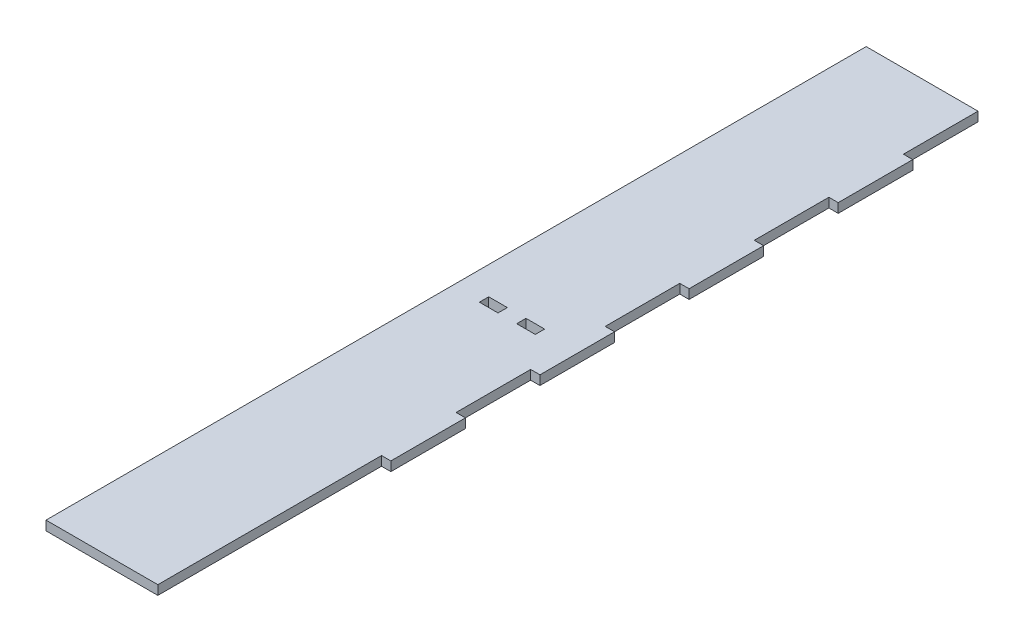
from build123d import *

# Parameters (mm, degrees)
SKETCH1_W           = 76.2
SKETCH1_H           = 6.35
BOSS_EXTRUDE1_DEPTH = 558.8
SKETCH2_W           = 12.7
SKETCH2_H           = 6.35
CUT_EXTRUDE1_DEPTH  = 561.133352426
SKETCH3_W           = 50.8
SKETCH3_H           = 6.35
BOSS_EXTRUDE2_DEPTH = 6.35


with BuildPart() as part:
    # Sketch1 → Boss-Extrude1 (new body)
    with BuildSketch(Plane.XY):
        with Locations((0, 41.275)):
            Rectangle(SKETCH1_W, SKETCH1_H)
    extrude(amount=BOSS_EXTRUDE1_DEPTH)

    # Sketch2 → Cut-Extrude1 (cut, through all)
    with BuildSketch(Plane(origin=(0, 44.45, 0), x_dir=(1, 0, 0), z_dir=(0, 1, 0))):
        with Locations((12.7, -279.4)):
            Rectangle(SKETCH2_W, SKETCH2_H)
        with Locations((-12.7, -279.4)):
            Rectangle(SKETCH2_W, SKETCH2_H)
    extrude(amount=-CUT_EXTRUDE1_DEPTH, mode=Mode.SUBTRACT)

    # Sketch3 → Boss-Extrude2 (add)
    with BuildSketch(Plane(origin=(38.1, 0, 0), x_dir=(0, 0, -1), z_dir=(1, 0, 0))):
        with Locations((-381, 41.275)):
            Rectangle(SKETCH3_W, SKETCH3_H)
        with Locations((-279.4, 41.275)):
            Rectangle(SKETCH3_W, SKETCH3_H)
        with Locations((-177.8, 41.275)):
            Rectangle(SKETCH3_W, SKETCH3_H)
        with Locations((-76.2, 41.275)):
            Rectangle(SKETCH3_W, SKETCH3_H)
    extrude(amount=BOSS_EXTRUDE2_DEPTH)


solid = part.part
